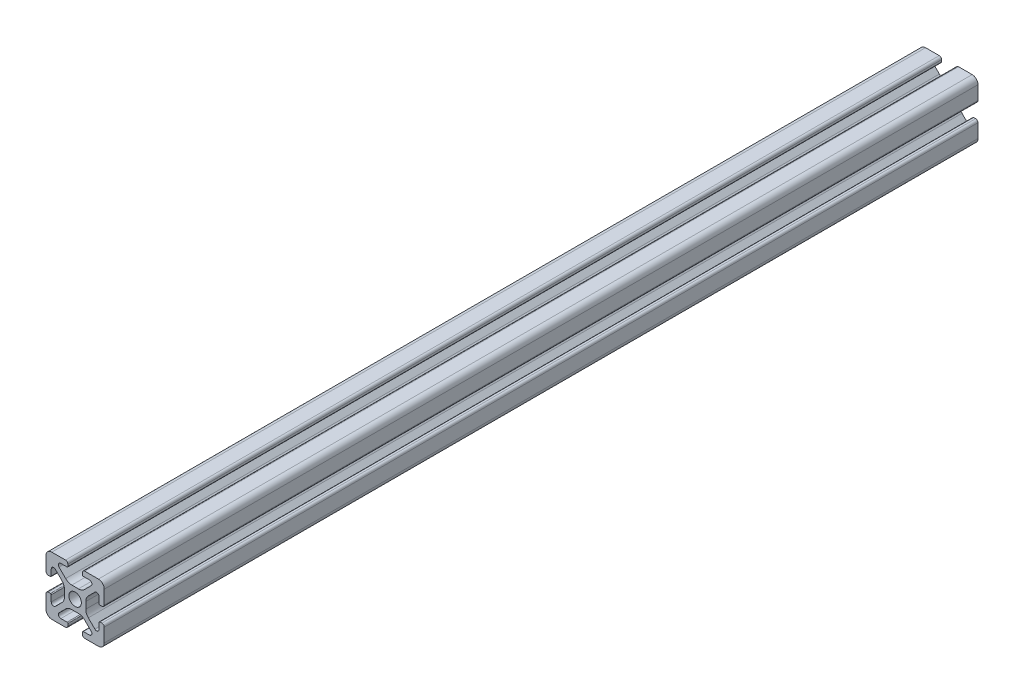
from build123d import *

# Parameters (mm, degrees)
BOSS_EXTRU_1_DEPTH = 300


with BuildPart() as part:
    # Esquisse1 → Boss.-Extru.1 (new body)
    with BuildSketch(Plane.XY):
        with BuildLine():
            Line((-3.255887446, 4.528679645), (-5.506192286, 6.778984485))
            ThreePointArc((-5.506192286, 6.778984485), (-5.686636441, 7.686138511), (-4.917588391, 8.199999989))
            Line((-4.917588391, 8.199999989), (-2.799999991, 8.199999989))
            ThreePointArc((-2.799999991, 8.199999989), (-2.587867957, 8.287867955), (-2.499999991, 8.499999989))
            Line((-2.499999991, 8.499999989), (-2.499999991, 9.199999989))
            ThreePointArc((-2.499999991, 9.199999989), (-2.734314566, 9.765685414), (-3.299999991, 9.999999989))
            Line((-3.299999991, 9.999999989), (-7.999999991, 9.999999989))
            ThreePointArc((-7.999999991, 9.999999989), (-9.414213554, 9.414213552), (-9.999999991, 7.999999989))
            Line((-9.999999991, 7.999999989), (-9.999999991, 3.299999989))
            ThreePointArc((-9.999999991, 3.299999989), (-9.765685416, 2.734314564), (-9.199999991, 2.499999989))
            Line((-9.199999991, 2.499999989), (-8.499999991, 2.499999989))
            ThreePointArc((-8.499999991, 2.499999989), (-8.287867957, 2.587867955), (-8.199999991, 2.799999989))
            Line((-8.199999991, 2.799999989), (-8.199999991, 4.917588389))
            ThreePointArc((-8.199999991, 4.917588389), (-7.686138517, 5.686636433), (-6.778984497, 5.506192279))
            Line((-6.778984497, 5.506192279), (-4.528679657, 3.255887439))
            ThreePointArc((-4.528679657, 3.255887439), (-3.878361403, 2.282617393), (-3.650000001, 1.134567096))
            Line((-3.650000001, 1.134567096), (-3.650000001, -1.134567114))
            ThreePointArc((-3.650000001, -1.134567114), (-3.878361403, -2.282617409), (-4.528679656, -3.255887454))
            Line((-4.528679656, -3.255887454), (-6.778984496, -5.506192294))
            ThreePointArc((-6.778984496, -5.506192294), (-7.686138522, -5.686636449), (-8.2, -4.9175884))
            Line((-8.2, -4.9175884), (-8.2, -2.8))
            ThreePointArc((-8.2, -2.8), (-8.287867966, -2.587867966), (-8.5, -2.5))
            Line((-8.5, -2.5), (-9.2, -2.5))
            ThreePointArc((-9.2, -2.5), (-9.765685425, -2.734314575), (-10, -3.3))
            Line((-10, -3.3), (-10, -8))
            ThreePointArc((-10, -8), (-9.414213562, -9.414213562), (-8, -10))
            Line((-8, -10), (-3.3, -10))
            ThreePointArc((-3.3, -10), (-2.734314575, -9.765685425), (-2.5, -9.2))
            Line((-2.5, -9.2), (-2.5, -8.5))
            ThreePointArc((-2.5, -8.5), (-2.587867966, -8.287867966), (-2.8, -8.2))
            Line((-2.8, -8.2), (-4.9175884, -8.2))
            ThreePointArc((-4.9175884, -8.2), (-5.686636444, -7.686138526), (-5.50619229, -6.778984506))
            Line((-5.50619229, -6.778984506), (-3.25588745, -4.528679666))
            ThreePointArc((-3.25588745, -4.528679666), (-2.282617404, -3.878361412), (-1.134567106, -3.650000009))
            Line((-1.134567106, -3.650000009), (1.134567104, -3.650000009))
            ThreePointArc((1.134567104, -3.650000009), (2.282617399, -3.878361412), (3.255887444, -4.528679664))
            Line((3.255887444, -4.528679664), (5.506192284, -6.778984504))
            ThreePointArc((5.506192284, -6.778984504), (5.686636439, -7.686138531), (4.917588389, -8.200000009))
            Line((4.917588389, -8.200000009), (2.799999989, -8.200000009))
            ThreePointArc((2.799999989, -8.200000009), (2.587867955, -8.287867974), (2.499999989, -8.500000009))
            Line((2.499999989, -8.500000009), (2.499999989, -9.200000009))
            ThreePointArc((2.499999989, -9.200000009), (2.734314564, -9.765685434), (3.299999989, -10.000000009))
            Line((3.299999989, -10.000000009), (7.999999989, -10.000000009))
            ThreePointArc((7.999999989, -10.000000009), (9.414213552, -9.414213571), (9.999999989, -8.000000009))
            Line((9.999999989, -8.000000009), (9.999999989, -3.300000009))
            ThreePointArc((9.999999989, -3.300000009), (9.765685414, -2.734314584), (9.199999989, -2.500000009))
            Line((9.199999989, -2.500000009), (8.499999989, -2.500000009))
            ThreePointArc((8.499999989, -2.500000009), (8.287867955, -2.587867974), (8.199999989, -2.800000009))
            Line((8.199999989, -2.800000009), (8.199999989, -4.917588409))
            ThreePointArc((8.199999989, -4.917588409), (7.686138515, -5.686636452), (6.778984495, -5.506192299))
            Line((6.778984495, -5.506192299), (4.528679655, -3.255887459))
            ThreePointArc((4.528679655, -3.255887459), (3.878361401, -2.282617412), (3.649999999, -1.134567115))
            Line((3.649999999, -1.134567115), (3.649999999, 1.134567095))
            ThreePointArc((3.649999999, 1.134567095), (3.878361401, 2.28261739), (4.528679654, 3.255887435))
            Line((4.528679654, 3.255887435), (6.778984494, 5.506192275))
            ThreePointArc((6.778984494, 5.506192275), (7.68613852, 5.68663643), (8.199999998, 4.917588381))
            Line((8.199999998, 4.917588381), (8.199999998, 2.799999981))
            ThreePointArc((8.199999998, 2.799999981), (8.287867964, 2.587867946), (8.499999998, 2.499999981))
            Line((8.499999998, 2.499999981), (9.199999998, 2.499999981))
            ThreePointArc((9.199999998, 2.499999981), (9.765685423, 2.734314556), (9.999999998, 3.299999981))
            Line((9.999999998, 3.299999981), (9.999999998, 7.999999981))
            ThreePointArc((9.999999998, 7.999999981), (9.41421356, 9.414213543), (7.999999998, 9.999999981))
            Line((7.999999998, 9.999999981), (3.299999998, 9.999999981))
            ThreePointArc((3.299999998, 9.999999981), (2.734314573, 9.765685406), (2.499999998, 9.199999981))
            Line((2.499999998, 9.199999981), (2.499999998, 8.499999981))
            ThreePointArc((2.499999998, 8.499999981), (2.587867964, 8.287867946), (2.799999998, 8.199999981))
            Line((2.799999998, 8.199999981), (4.917588398, 8.199999981))
            ThreePointArc((4.917588398, 8.199999981), (5.686636442, 7.686138507), (5.506192288, 6.778984487))
            Line((5.506192288, 6.778984487), (3.255887448, 4.528679647))
            ThreePointArc((3.255887448, 4.528679647), (2.282617402, 3.878361393), (1.134567104, 3.64999999))
            Line((1.134567104, 3.64999999), (-1.134567106, 3.64999999))
            ThreePointArc((-1.134567106, 3.64999999), (-2.282617401, 3.878361392), (-3.255887446, 4.528679645))
        make_face()
        with BuildLine():
            ThreePointArc((-2.15, 0), (0, -2.15), (2.15, 0))
            ThreePointArc((2.15, 0), (0, 2.15), (-2.15, 0))
        make_face(mode=Mode.SUBTRACT)
    extrude(amount=BOSS_EXTRU_1_DEPTH)


solid = part.part
